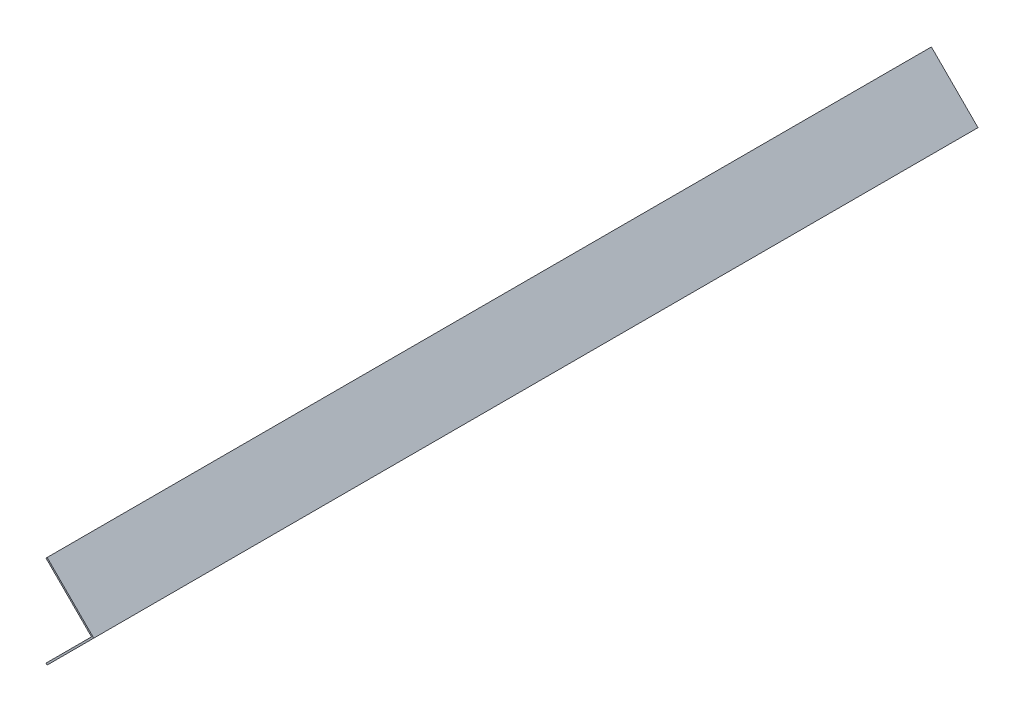
from build123d import *

# Parameters (mm, degrees)
BOSS_EXTRUDE1_DEPTH = 275


with BuildPart() as part:
    # Sketch1 → Boss-Extrude1 (new, symmetric)
    with BuildSketch(Plane.XY):
        Polygon((0, 0), (-28.284271247, 28.284271247), (-27.577164466, 28.991378029), (1.414213562, 0), (-27.577164466, -28.991378029), (-28.284271247, -28.284271247), align=None)
    extrude(amount=BOSS_EXTRUDE1_DEPTH, both=True)


solid = part.part
